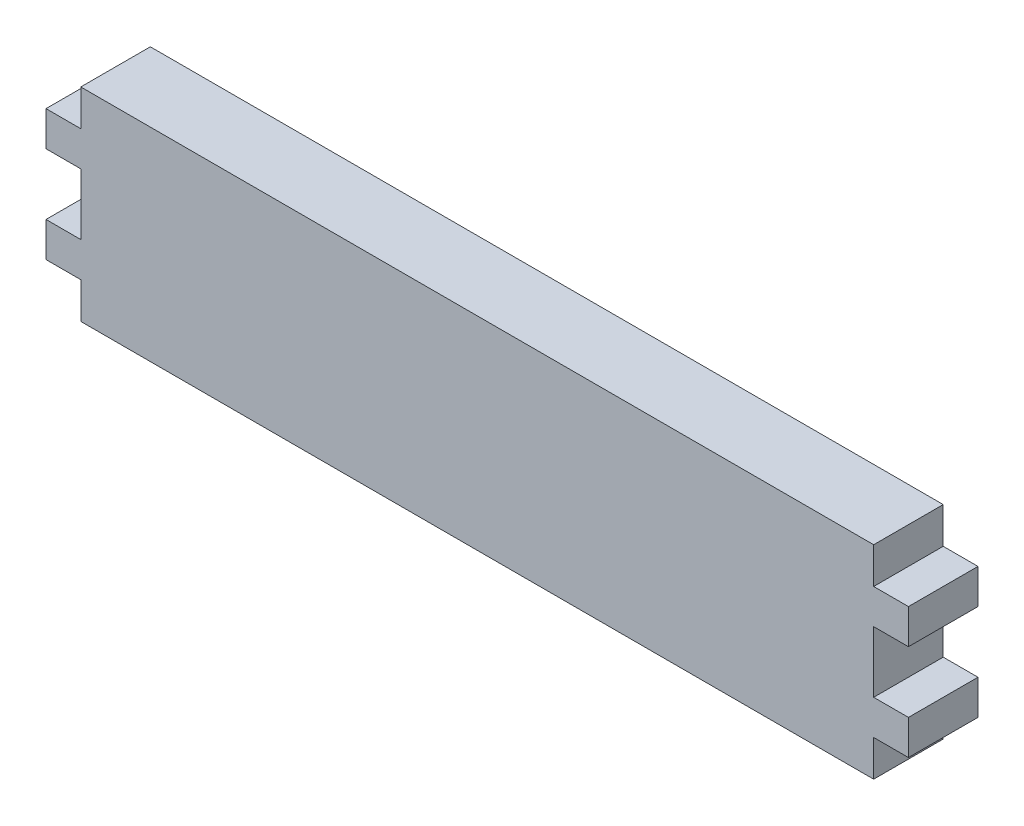
from build123d import *

# Parameters (mm, degrees)
BOSS_EXTRUDE1_DEPTH = 6.35


with BuildPart() as part:
    # Sketch1 → Boss-Extrude1 (new body)
    with BuildSketch(Plane.XY):
        Polygon((305.412272516, -22.527216546), (308.587272516, -22.527216546), (308.587272516, -19.352216546), (305.412272516, -19.352216546), (305.412272516, -13.764216546), (308.587272516, -13.764216546), (308.587272516, -10.589216546), (305.412272516, -10.589216546), (305.412272516, -7.287216546), (233.022272516, -7.287216546), (233.022272516, -10.589216546), (229.847272516, -10.589216546), (229.847272516, -13.764216546), (233.022272516, -13.764216546), (233.022272516, -19.352216546), (229.847272516, -19.352216546), (229.847272516, -22.527216546), (233.022272516, -22.527216546), (233.022272516, -25.829216546), (305.412272516, -25.829216546), align=None)
    extrude(amount=BOSS_EXTRUDE1_DEPTH)


solid = part.part
